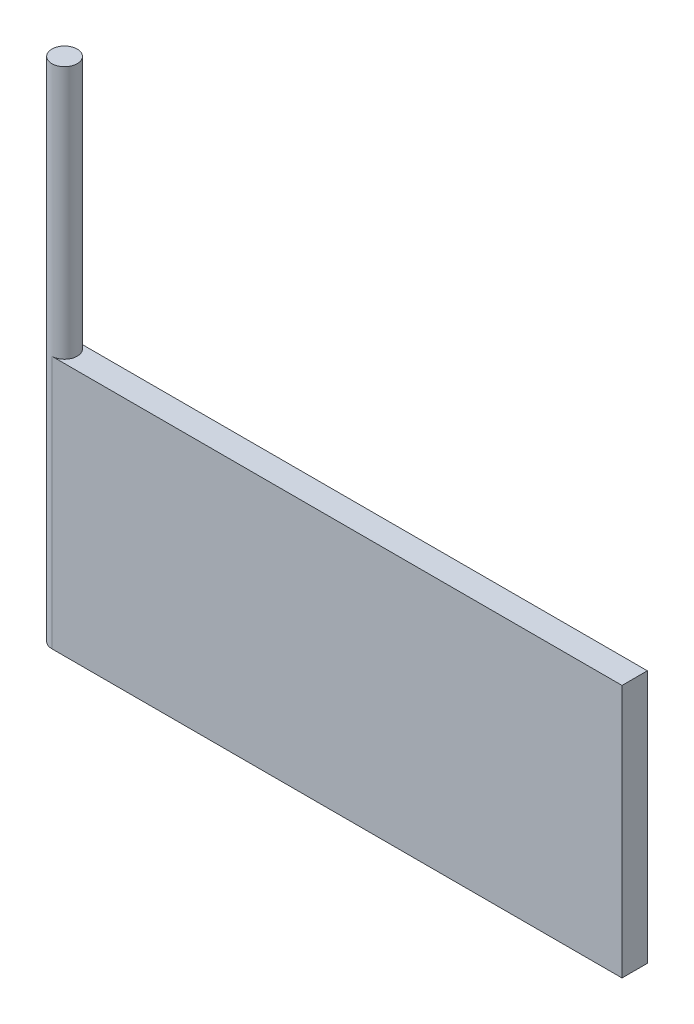
from build123d import *

# Parameters (mm, degrees)
SKETCH1_W           = 90
SKETCH1_H           = 40
BOSS_EXTRUDE1_DEPTH = 2
SKETCH4_R           = 2
BOSS_EXTRUDE2_DEPTH = 80


with BuildPart() as part:
    # Sketch1 → Boss-Extrude1 (new, symmetric)
    with BuildSketch(Plane.XY):
        with Locations((45, 0)):
            Rectangle(SKETCH1_W, SKETCH1_H)
    extrude(amount=BOSS_EXTRUDE1_DEPTH, both=True)

    # Sketch4 → Boss-Extrude2 (add)
    with BuildSketch(Plane.XZ.offset(20)):
        with Locations(Location((0, 0, 0), (0, 0, 270))):
            Circle(SKETCH4_R)
    extrude(amount=-BOSS_EXTRUDE2_DEPTH)


solid = part.part
